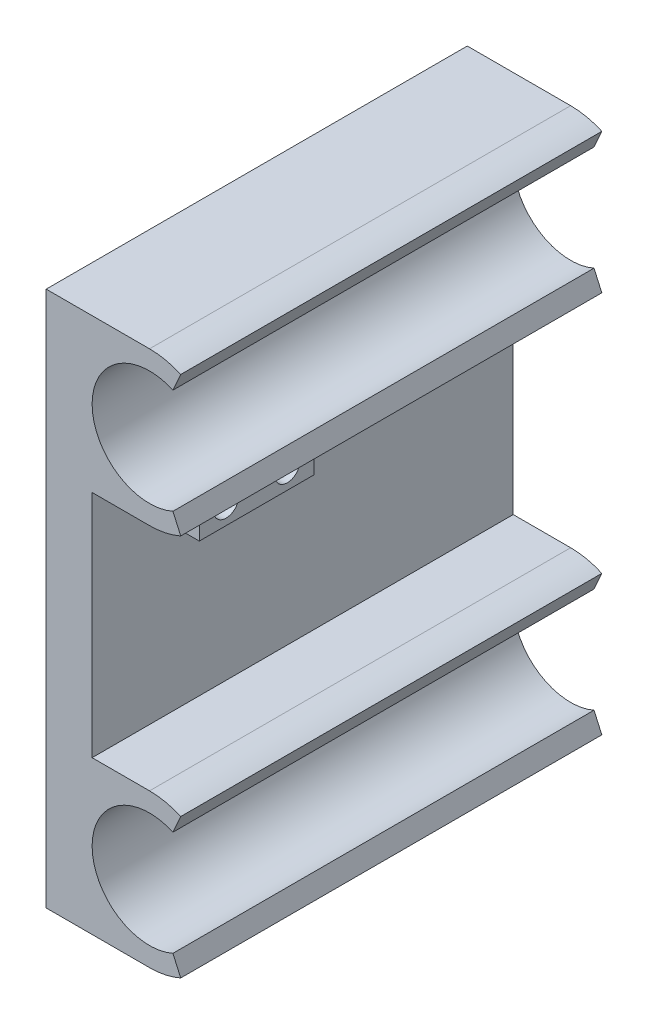
from build123d import *

# Parameters (mm, degrees)
RESSALTO_EXTRUS_O1_DEPTH = 55
ESBO_O3_W                = 15
ESBO_O3_H                = 5
ESBO_O3_R                = 1.65
RESSALTO_EXTRUS_O2_DEPTH = 10


with BuildPart() as part:
    # Esboço1 → Ressalto-extrusão1 (new body)
    with BuildSketch(Plane.XY):
        with BuildLine():
            Line((0, 35), (0, -35))
            Line((0, -35), (13.5, -35))
            ThreePointArc((13.5, -35), (15.581665999, -34.780933834), (17.572127481, -34.133333333))
            Line((17.572127481, -34.133333333), (16.554095611, -31.85))
            ThreePointArc((16.554095611, -31.85), (6, -25), (16.554095611, -18.15))
            Line((16.554095611, -18.15), (17.572127481, -15.866666667))
            ThreePointArc((17.572127481, -15.866666667), (15.581665999, -15.219066166), (13.5, -15))
            Line((13.5, -15), (6, -15))
            Line((6, -15), (6, 15))
            Line((6, 15), (13.5, 15))
            ThreePointArc((13.5, 15), (15.581665999, 15.219066166), (17.572127481, 15.866666667))
            Line((17.572127481, 15.866666667), (16.554095611, 18.15))
            ThreePointArc((16.554095611, 18.15), (6, 25), (16.554095611, 31.85))
            Line((16.554095611, 31.85), (17.572127481, 34.133333333))
            ThreePointArc((17.572127481, 34.133333333), (15.581665999, 34.780933834), (13.5, 35))
            Line((13.5, 35), (0, 35))
        make_face()
    extrude(amount=RESSALTO_EXTRUS_O1_DEPTH)

    # Esboço3 → Ressalto-extrusão2 (add)
    with BuildSketch(Plane(origin=(6, 0, 0), x_dir=(0, 0, -1), z_dir=(1, 0, 0))):
        with Locations((-43.5, 15)):
            Rectangle(ESBO_O3_W, ESBO_O3_H)
        with Locations((-47.5, 15)):
            Circle(ESBO_O3_R, mode=Mode.SUBTRACT)
        with Locations((-39.5, 15)):
            Circle(ESBO_O3_R, mode=Mode.SUBTRACT)
    extrude(amount=RESSALTO_EXTRUS_O2_DEPTH)


solid = part.part
